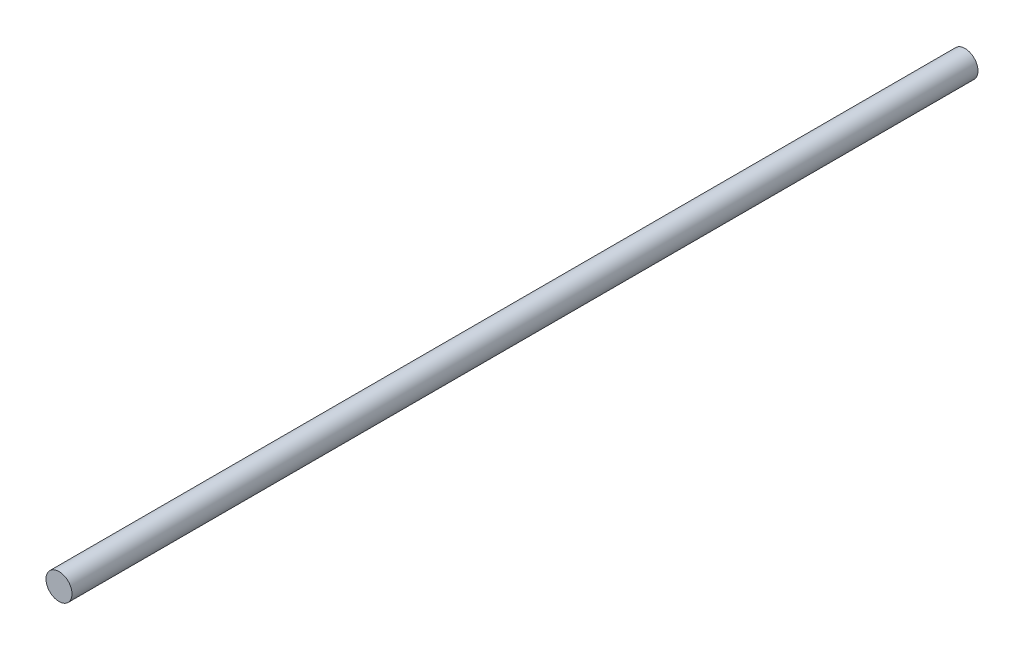
from build123d import *

# Parameters (mm, degrees)
SKETCH1_R           = 3.175
BOSS_EXTRUDE1_DEPTH = 220.98


with BuildPart() as part:
    # Sketch1 → Boss-Extrude1 (new body)
    with BuildSketch(Plane.XY):
        Circle(SKETCH1_R)
    extrude(amount=BOSS_EXTRUDE1_DEPTH)


solid = part.part
